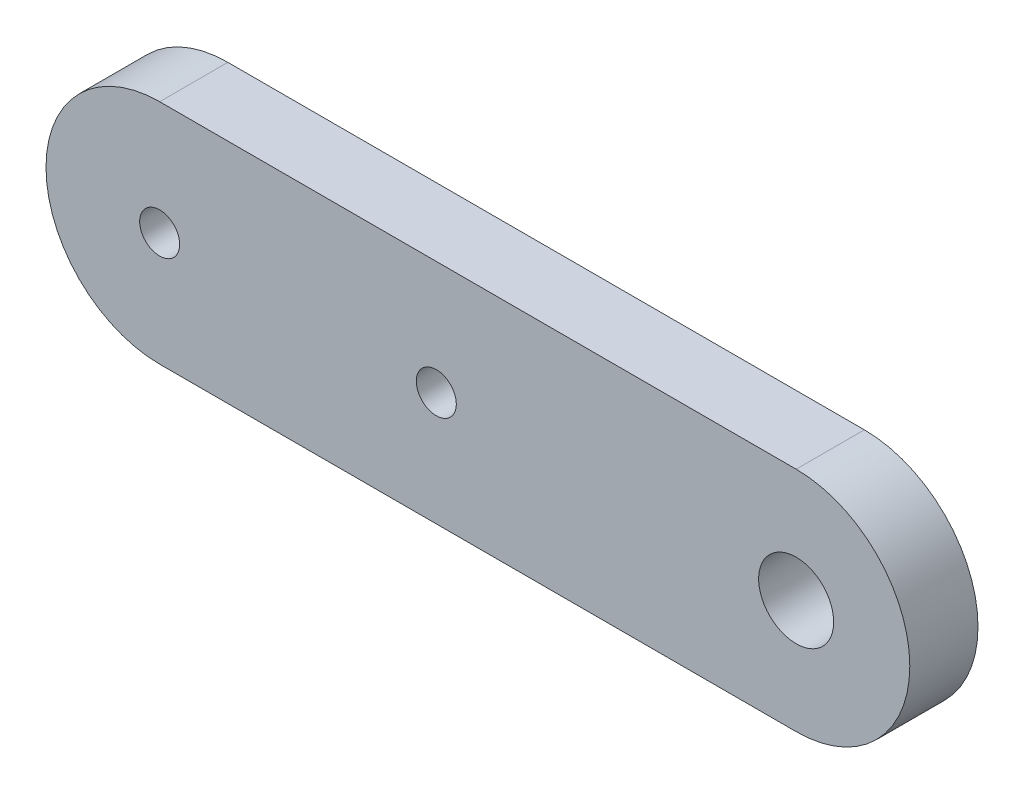
from build123d import *

# Parameters (mm, degrees)
SKETCH_1_R      = 0.88
SKETCH_1_R_2    = 1.65
EXTRUDE_1_DEPTH = 3


with BuildPart() as part:
    # 草图1 → 凸台-拉伸1 (new body)
    with BuildSketch(Plane.XY):
        with BuildLine():
            Line((0, 0), (28, 0))
            ThreePointArc((28, 0), (33, -5), (28, -10))
            Line((28, -10), (0, -10))
            ThreePointArc((0, -10), (-5, -5), (0, 0))
        make_face()
        with Locations((0, -5)):
            Circle(SKETCH_1_R, mode=Mode.SUBTRACT)
        with Locations((28, -5)):
            Circle(SKETCH_1_R_2, mode=Mode.SUBTRACT)
        with Locations((12.17, -5)):
            Circle(SKETCH_1_R, mode=Mode.SUBTRACT)
    extrude(amount=EXTRUDE_1_DEPTH)


solid = part.part
